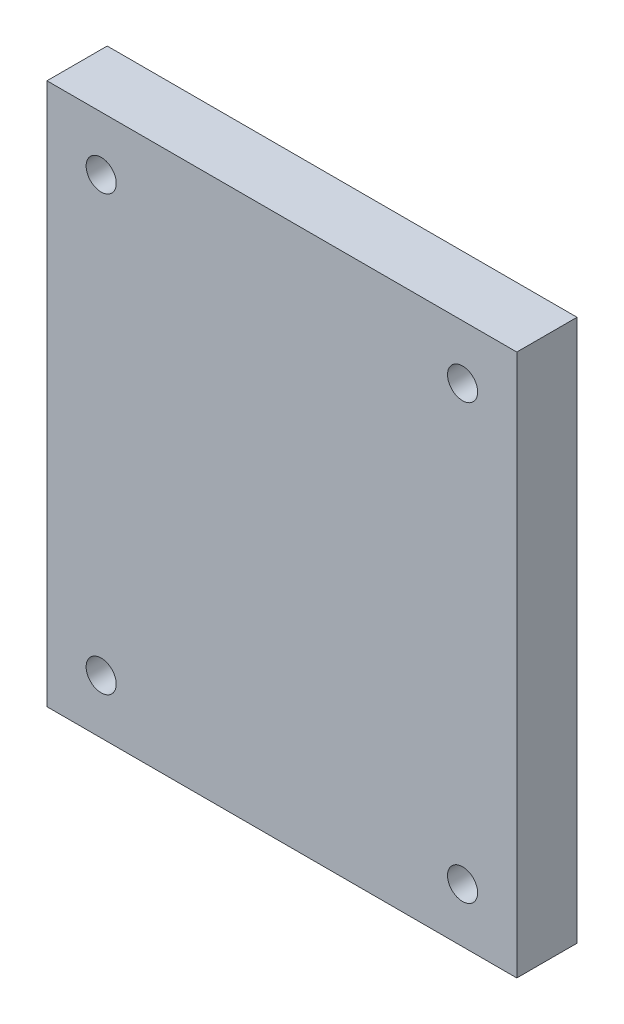
from build123d import *

# Parameters (mm, degrees)
SKETCH1_W           = 39
SKETCH1_H           = 45
SKETCH1_R           = 1.25
BOSS_EXTRUDE1_DEPTH = 5


with BuildPart() as part:
    # Sketch1 → Boss-Extrude1 (new body)
    with BuildSketch(Plane.XY):
        Rectangle(SKETCH1_W, SKETCH1_H)
        with Locations((15, 18)):
            Circle(SKETCH1_R, mode=Mode.SUBTRACT)
        with Locations((-15, 18)):
            Circle(SKETCH1_R, mode=Mode.SUBTRACT)
        with Locations((15, -18)):
            Circle(SKETCH1_R, mode=Mode.SUBTRACT)
        with Locations((-15, -18)):
            Circle(SKETCH1_R, mode=Mode.SUBTRACT)
    extrude(amount=BOSS_EXTRUDE1_DEPTH)


solid = part.part
